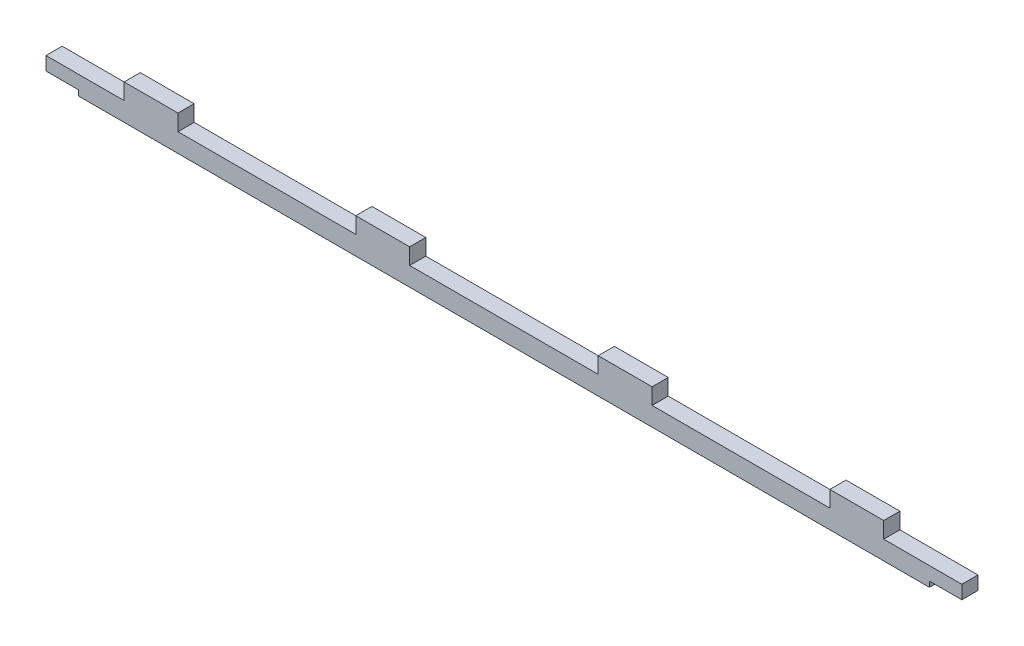
from build123d import *

# Parameters (mm, degrees)
EXTRUDE_1_DEPTH = 3


with BuildPart() as part:
    # 草图1 → 凸台-拉伸1 (new body)
    with BuildSketch(Plane.XY):
        Polygon((-85, 1), (-85, 3.5), (-70.5, 3.5), (-70.5, 6.5), (-60.5, 6.5), (-60.5, 3.5), (-27.5, 3.5), (-27.5, 6.5), (-17.5, 6.5), (-17.5, 3.5), (17.5, 3.5), (17.5, 6.5), (27.5, 6.5), (27.5, 3.5), (60.5, 3.5), (60.5, 6.5), (70.5, 6.5), (70.5, 3.5), (85, 3.5), (85, 1), (79, 1), (79, 0), (-79, 0), (-79, 1), align=None)
    extrude(amount=EXTRUDE_1_DEPTH)


solid = part.part
